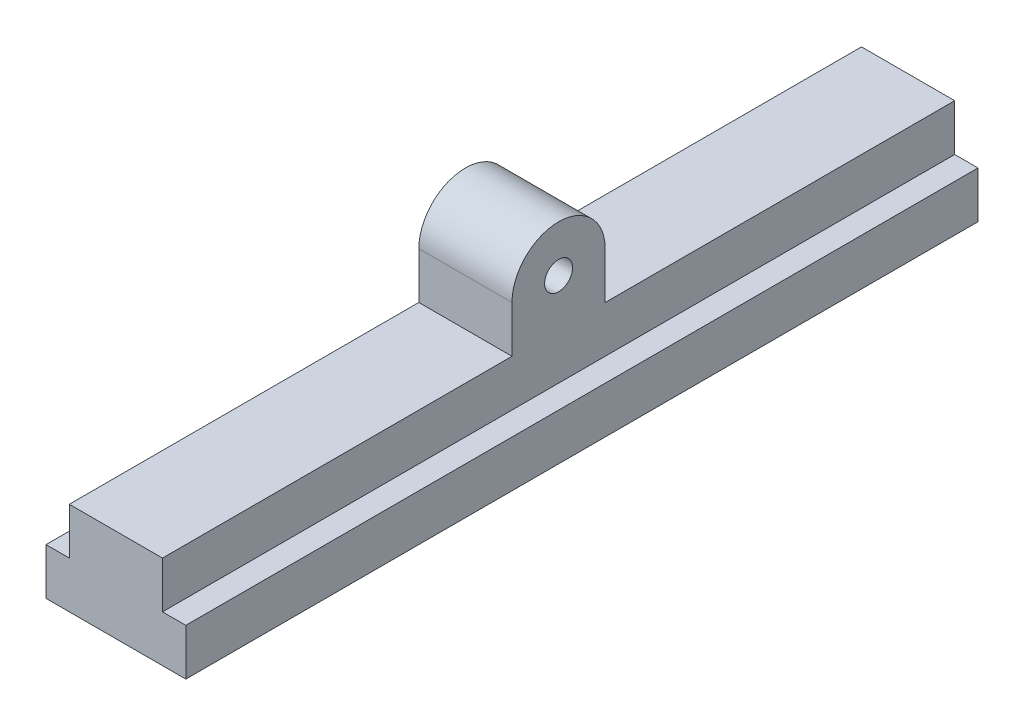
from build123d import *

# Parameters (mm, degrees)
EXTRUDE_3_DEPTH     = 240
EXTRUDE_5_DEPTH     = 100
SKETCH_9_W          = 30
SKETCH_9_H          = 170
CUT_EXTRUDE_1_DEPTH = 60
EXTRUDE_6_DEPTH     = 20


with BuildPart() as part:
    # 草图1 → 凸台-拉伸3 (new body)
    with BuildSketch(Plane.XY):
        Polygon((24.986954743, -11.866003736), (-5.013045257, -11.866003736), (-5.013045257, -1.866003736), (-0.013045257, -1.866003736), (-0.013045257, 8.133996264), (19.986954743, 8.133996264), (19.986954743, -1.866003736), (24.986954743, -1.866003736), align=None)
    extrude(amount=EXTRUDE_3_DEPTH)

    # 草图4 → 凸台-拉伸5 (add)
    with BuildSketch(Plane(origin=(0, 0, 0), x_dir=(-1, 0, 0), z_dir=(0, 0, -1))):
        Polygon((-19.986954743, 8.133996264), (0.013045257, 8.133996264), (0.013045257, -1.866003736), (5.013045257, -1.866003736), (5.013045257, -11.866003736), (-24.986954743, -11.866003736), (-24.986954743, -1.866003736), (-19.986954743, -1.866003736), align=None)
    extrude(amount=EXTRUDE_5_DEPTH)

    # 草图9 → 切除-拉伸1 (cut)
    with BuildSketch(Plane.XZ.offset(11.866003736)):
        with Locations((9.986954743, -15)):
            Rectangle(SKETCH_9_W, SKETCH_9_H)
    extrude(amount=-CUT_EXTRUDE_1_DEPTH, mode=Mode.SUBTRACT)

    # 草图11 → 凸台-拉伸6 (add)
    with BuildSketch(Plane(origin=(19.986954743, 0, 0), x_dir=(0, 0, -1), z_dir=(1, 0, 0))):
        with BuildLine():
            ThreePointArc((-145, 18.133996264), (-155, 28.133996264), (-165, 18.133996264))
            Line((-165, 18.133996264), (-158, 18.133996264))
            ThreePointArc((-158, 18.133996264), (-155, 21.133996264), (-152, 18.133996264))
            Line((-152, 18.133996264), (-145, 18.133996264))
        make_face()
        with BuildLine():
            Line((-158, 18.133996264), (-165, 18.133996264))
            ThreePointArc((-165, 18.133996264), (-162.071067812, 11.062928453), (-155, 8.133996264))
            ThreePointArc((-155, 8.133996264), (-147.928932188, 11.062928453), (-145, 18.133996264))
            Line((-145, 18.133996264), (-152, 18.133996264))
            ThreePointArc((-152, 18.133996264), (-155, 15.133996264), (-158, 18.133996264))
        make_face()
        with BuildLine():
            ThreePointArc((-145, 18.133996264), (-147.928932188, 11.062928453), (-155, 8.133996264))
            Line((-155, 8.133996264), (-145, 8.133996264))
            Line((-145, 8.133996264), (-145, 18.133996264))
        make_face()
        with BuildLine():
            Line((-165, 18.133996264), (-165, 8.133996264))
            Line((-165, 8.133996264), (-155, 8.133996264))
            ThreePointArc((-155, 8.133996264), (-162.071067812, 11.062928453), (-165, 18.133996264))
        make_face()
    extrude(amount=-EXTRUDE_6_DEPTH)


solid = part.part
